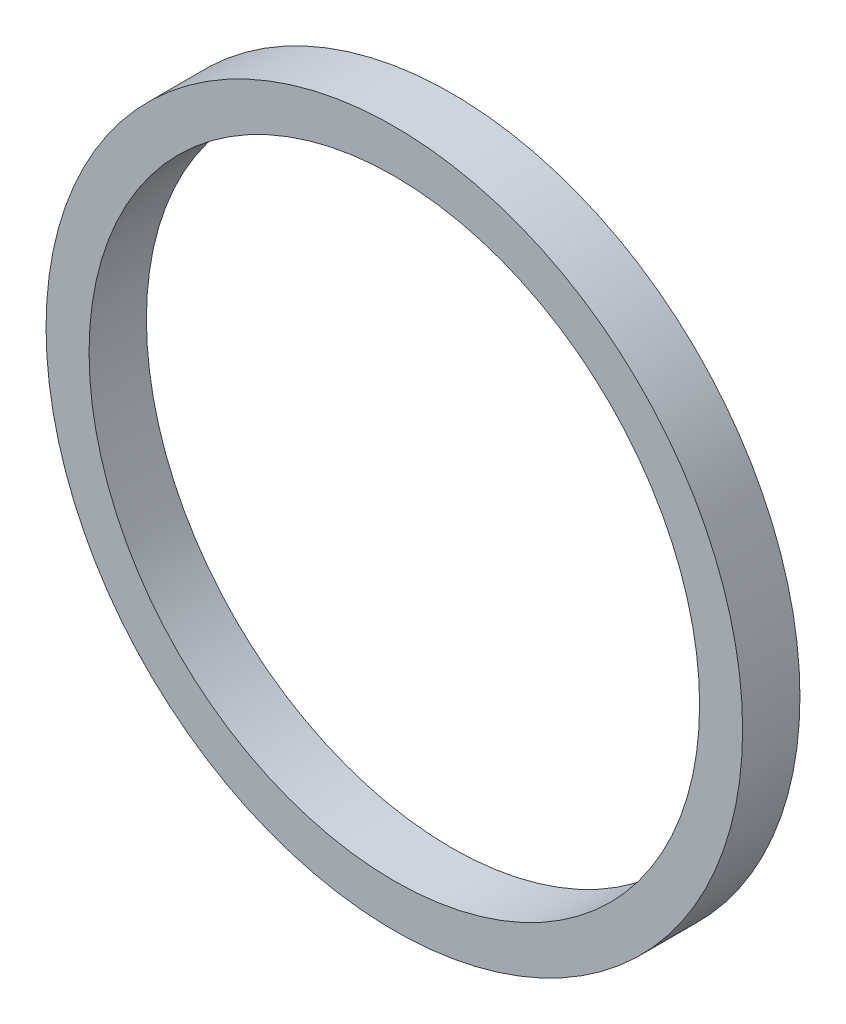
from build123d import *

# Parameters (mm, degrees)
SKETCH_1_R      = 12.15
SKETCH_1_R_2    = 10.65
EXTRUDE_1_DEPTH = 2


with BuildPart() as part:
    # Эскиз1 → Бобышка-Вытянуть1 (new body)
    with BuildSketch(Plane.XY):
        Circle(SKETCH_1_R)
        Circle(SKETCH_1_R_2, mode=Mode.SUBTRACT)
    extrude(amount=EXTRUDE_1_DEPTH)


solid = part.part
